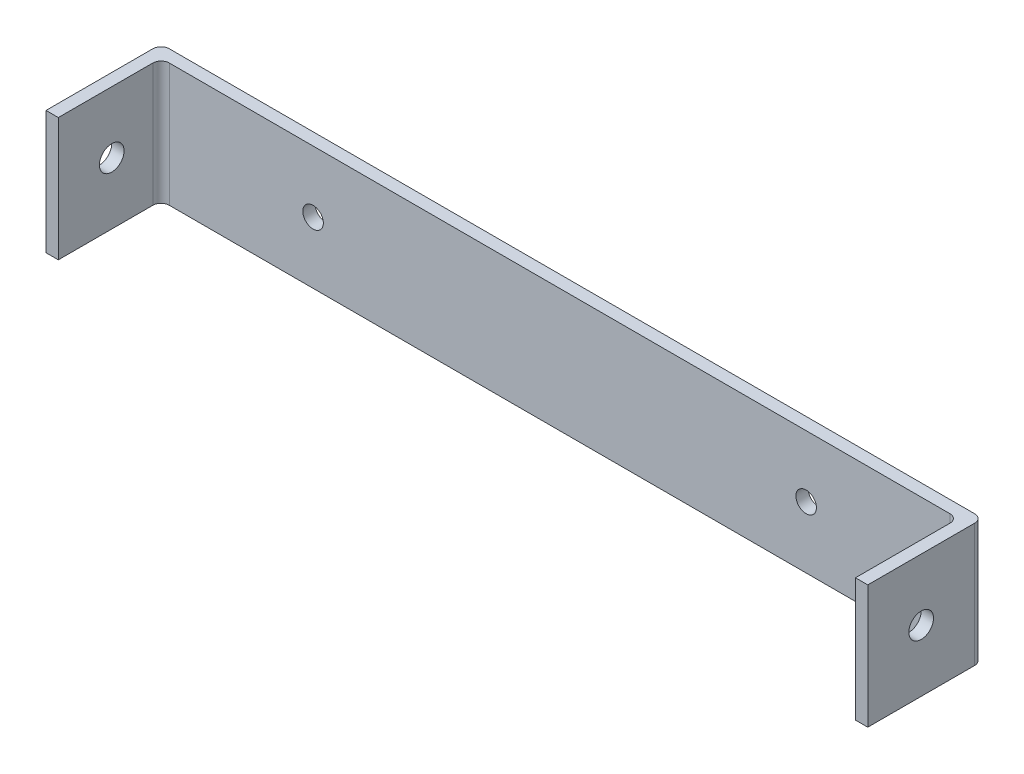
from build123d import *

# Parameters (mm, degrees)
ESQUISSE1_W             = 200
ESQUISSE1_H             = 30
ESQUISSE1_R             = 2.5
BOSS_EXTRU_1_DEPTH      = 3
ESQUISSE2_W             = 3
ESQUISSE2_H             = 30
BOSS_EXTRU_2_DEPTH      = 25
ESQUISSE3_R             = 3
ENL_V_MAT_EXTRU_1_DEPTH = 229
CONG_1_R                = 2


with BuildPart() as part:
    # Esquisse1 → Boss.-Extru.1 (new body)
    with BuildSketch(Plane.XY):
        with Locations((100, -15)):
            Rectangle(ESQUISSE1_W, ESQUISSE1_H)
        with Locations((40, -15)):
            Circle(ESQUISSE1_R, mode=Mode.SUBTRACT)
        with Locations((160, -15)):
            Circle(ESQUISSE1_R, mode=Mode.SUBTRACT)
    extrude(amount=BOSS_EXTRU_1_DEPTH)

    # Esquisse2 → Boss.-Extru.2 (add)
    with BuildSketch(Plane.XY.offset(3)):
        with Locations((1.5, -15)):
            Rectangle(ESQUISSE2_W, ESQUISSE2_H)
        with Locations((198.5, -15)):
            Rectangle(ESQUISSE2_W, ESQUISSE2_H)
    extrude(amount=BOSS_EXTRU_2_DEPTH)

    # Esquisse3 → Enlèv. mat.-Extru.1 (cut)
    with BuildSketch(Plane.ZY):
        with Locations((15, -15)):
            Circle(ESQUISSE3_R)
    extrude(amount=-ENL_V_MAT_EXTRU_1_DEPTH, mode=Mode.SUBTRACT)

    # Congé1
    cong_1_edges = [part.edges().sort_by_distance(p)[0] for p in [
        (3, -15, 3),
        (197, -15, 3),
        (200, -15, 0),
        (0, -15, 0),
    ]]
    fillet(cong_1_edges, radius=CONG_1_R)


solid = part.part
